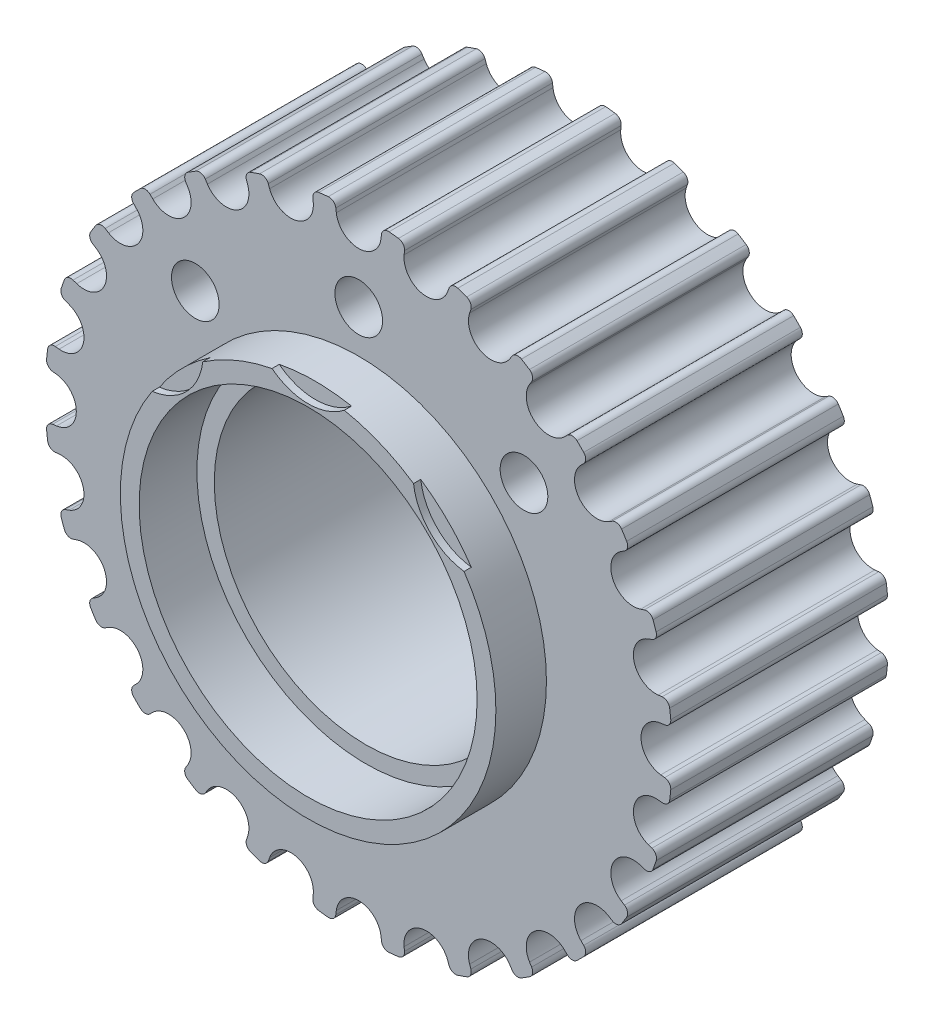
from build123d import *

# Parameters (mm, degrees)
SKETCH_2_R           = 10.5
EXTRUDE_1_DEPTH      = 15
EXTRUDE_2_DEPTH      = 3.5
EXTRUDE_2_DEPTH_BACK = 19.5
SKETCH_12_R          = 13
SKETCH_12_R_2        = 11.7
HOLE_WIZARD_M4_1_D   = 3.3
CUT_EXTRUDE_START    = -0.5
SKETCH_14_R          = 11.7
SKETCH_14_R_2        = 10.5
CUT_EXTRUDE_1_DEPTH  = 0.5
CUT_EXTRUDE_START_2  = 3.5
SKETCH_15_R          = 4.05
CUT_EXTRUDE_2_DEPTH  = 0.5
CUT_EXTRUDE_START_3  = -18
SKETCH_15_2_R        = 4.05
CUT_EXTRUDE_3_DEPTH  = 1.5
EXTRUDE_START        = 0.5
SKETCH_16_R          = 11.7
SKETCH_16_R_2        = 10.5
EXTRUDE_3_DEPTH      = 0.5


with BuildPart() as part:
    # 草图2 → 凸台-拉伸1 (new body)
    with BuildSketch(Plane.XY):
        with BuildLine():
            Line((1.331903556, 20.780403486), (1.298918642, 20.511762921))
            ThreePointArc((1.298918642, 20.511762921), (-0.249453355, 19.141879097), (-1.797825351, 20.511762921))
            Line((-1.797825351, 20.511762921), (-1.830810265, 20.780403486))
            ThreePointArc((-1.830810265, 20.780403486), (-2.006994407, 21.096415396), (-2.353762187, 21.19964565))
            ThreePointArc((-2.353762187, 21.19964565), (-2.679978202, 21.165383749), (-3.00563929, 21.12619674))
            ThreePointArc((-3.00563929, 21.12619674), (-3.320741986, 20.948391594), (-3.422189558, 20.601098103))
            Line((-3.422189558, 20.601098103), (-3.394569322, 20.331853084))
            ThreePointArc((-3.394569322, 20.331853084), (-4.599292572, 18.651769924), (-6.413671477, 19.642762718))
            Line((-6.413671477, 19.642762718), (-6.50560754, 19.897328069))
            ThreePointArc((-6.50560754, 19.897328069), (-6.747693643, 20.166212241), (-7.108738124, 20.189691206))
            ThreePointArc((-7.108738124, 20.189691206), (-7.419151232, 20.083698431), (-7.727927386, 19.973027513))
            ThreePointArc((-7.727927386, 19.973027513), (-7.995564432, 19.729563367), (-8.01718843, 19.36840304))
            Line((-8.01718843, 19.36840304), (-7.930348038, 19.112054636))
            ThreePointArc((-7.930348038, 19.112054636), (-8.731012687, 17.206018527), (-10.720417968, 17.768427773))
            Line((-10.720417968, 17.768427773), (-10.866695121, 17.996152941))
            ThreePointArc((-10.866695121, 17.996152941), (-11.162543977, 18.2044264), (-11.51976088, 18.146976743))
            ThreePointArc((-11.51976088, 18.146976743), (-11.798805672, 17.974568014), (-12.075213567, 17.797962688))
            ThreePointArc((-12.075213567, 17.797962688), (-12.281964525, 17.501047851), (-12.222680631, 17.144130775))
            Line((-12.222680631, 17.144130775), (-12.080974622, 16.913533367))
            ThreePointArc((-12.080974622, 16.913533367), (-12.437432001, 14.877120916), (-14.502106569, 14.982745068))
            Line((-14.502106569, 14.982745068), (-14.695389866, 15.172210962))
            ThreePointArc((-14.695389866, 15.172210962), (-15.030166378, 15.309430006), (-15.365643356, 15.173932493))
            ThreePointArc((-15.365643356, 15.173932493), (-15.599327361, 14.943753103), (-15.829506751, 14.710069098))
            ThreePointArc((-15.829506751, 14.710069098), (-15.965004264, 14.37459212), (-15.82778522, 14.039815608))
            Line((-15.82778522, 14.039815608), (-15.638319326, 13.846532311))
            ThreePointArc((-15.638319326, 13.846532311), (-15.532695174, 11.781857744), (-17.569107624, 11.425400364))
            Line((-17.569107624, 11.425400364), (-17.799705033, 11.567106373))
            ThreePointArc((-17.799705033, 11.567106373), (-18.156622109, 11.626390267), (-18.453536946, 11.41963931))
            ThreePointArc((-18.453536946, 11.41963931), (-18.630142271, 11.143231414), (-18.802551001, 10.864186622))
            ThreePointArc((-18.802551001, 10.864186622), (-18.860000658, 10.506969719), (-18.651727199, 10.211120863))
            Line((-18.651727199, 10.211120863), (-18.424002031, 10.06484371))
            ThreePointArc((-18.424002031, 10.06484371), (-17.861592784, 8.075438429), (-19.767628894, 7.27477378))
            Line((-19.767628894, 7.27477378), (-20.023977298, 7.361614172))
            ThreePointArc((-20.023977298, 7.361614172), (-20.385137624, 7.339990175), (-20.628601771, 7.072353128))
            ThreePointArc((-20.628601771, 7.072353128), (-20.739272689, 6.763576974), (-20.845265464, 6.453163866))
            ThreePointArc((-20.845265464, 6.453163866), (-20.821786499, 6.092119385), (-20.552902327, 5.850033282))
            Line((-20.552902327, 5.850033282), (-20.298336976, 5.75809722))
            ThreePointArc((-20.298336976, 5.75809722), (-19.307344182, 3.943718314), (-20.987427341, 2.738995064))
            Line((-20.987427341, 2.738995064), (-21.25667236, 2.7666153))
            ThreePointArc((-21.25667236, 2.7666153), (-21.603965852, 2.665167728), (-21.781770998, 2.350065032))
            ThreePointArc((-21.781770998, 2.350065032), (-21.820958007, 2.024403944), (-21.855219907, 1.69818793))
            ThreePointArc((-21.855219907, 1.69818793), (-21.751989654, 1.351420149), (-21.435977744, 1.175236007))
            Line((-21.435977744, 1.175236007), (-21.167337179, 1.142251093))
            ThreePointArc((-21.167337179, 1.142251093), (-19.797453355, -0.406120903), (-21.167337179, -1.9544929))
            Line((-21.167337179, -1.9544929), (-21.435977744, -1.987477814))
            ThreePointArc((-21.435977744, -1.987477814), (-21.751989654, -2.163661955), (-21.855219907, -2.510429736))
            ThreePointArc((-21.855219907, -2.510429736), (-21.820958007, -2.83664575), (-21.781770998, -3.162306838))
            ThreePointArc((-21.781770998, -3.162306838), (-21.603965852, -3.477409534), (-21.25667236, -3.578857107))
            Line((-21.25667236, -3.578857107), (-20.987427341, -3.55123687))
            ThreePointArc((-20.987427341, -3.55123687), (-19.307344182, -4.75596012), (-20.298336976, -6.570339026))
            Line((-20.298336976, -6.570339026), (-20.552902327, -6.662275089))
            ThreePointArc((-20.552902327, -6.662275089), (-20.821786499, -6.904361192), (-20.845265464, -7.265405672))
            ThreePointArc((-20.845265464, -7.265405672), (-20.739272689, -7.57581878), (-20.628601771, -7.884594935))
            ThreePointArc((-20.628601771, -7.884594935), (-20.385137624, -8.152231981), (-20.023977298, -8.173855979))
            Line((-20.023977298, -8.173855979), (-19.767628894, -8.087015586))
            ThreePointArc((-19.767628894, -8.087015586), (-17.861592784, -8.887680235), (-18.424002031, -10.877085516))
            Line((-18.424002031, -10.877085516), (-18.651727199, -11.023362669))
            ThreePointArc((-18.651727199, -11.023362669), (-18.860000658, -11.319211525), (-18.802551001, -11.676428428))
            ThreePointArc((-18.802551001, -11.676428428), (-18.630142271, -11.95547322), (-18.453536946, -12.231881116))
            ThreePointArc((-18.453536946, -12.231881116), (-18.156622109, -12.438632073), (-17.799705033, -12.379348179))
            Line((-17.799705033, -12.379348179), (-17.569107624, -12.237642171))
            ThreePointArc((-17.569107624, -12.237642171), (-15.532695174, -12.59409955), (-15.638319326, -14.658774118))
            Line((-15.638319326, -14.658774118), (-15.82778522, -14.852057414))
            ThreePointArc((-15.82778522, -14.852057414), (-15.965004264, -15.186833926), (-15.829506751, -15.522310905))
            ThreePointArc((-15.829506751, -15.522310905), (-15.599327361, -15.755994909), (-15.365643356, -15.9861743))
            ThreePointArc((-15.365643356, -15.9861743), (-15.030166378, -16.121671812), (-14.695389866, -15.984452768))
            Line((-14.695389866, -15.984452768), (-14.502106569, -15.794986874))
            ThreePointArc((-14.502106569, -15.794986874), (-12.437432001, -15.689362722), (-12.080974622, -17.725775173))
            Line((-12.080974622, -17.725775173), (-12.222680631, -17.956372582))
            ThreePointArc((-12.222680631, -17.956372582), (-12.281964525, -18.313289657), (-12.075213567, -18.610204494))
            ThreePointArc((-12.075213567, -18.610204494), (-11.798805672, -18.78680982), (-11.51976088, -18.95921855))
            ThreePointArc((-11.51976088, -18.95921855), (-11.162543977, -19.016668206), (-10.866695121, -18.808394748))
            Line((-10.866695121, -18.808394748), (-10.720417968, -18.58066958))
            ThreePointArc((-10.720417968, -18.58066958), (-8.731012687, -18.018260333), (-7.930348038, -19.924296443))
            Line((-7.930348038, -19.924296443), (-8.01718843, -20.180644846))
            ThreePointArc((-8.01718843, -20.180644846), (-7.995564432, -20.541805173), (-7.727927386, -20.785269319))
            ThreePointArc((-7.727927386, -20.785269319), (-7.419151232, -20.895940238), (-7.108738124, -21.001933013))
            ThreePointArc((-7.108738124, -21.001933013), (-6.747693643, -20.978454047), (-6.50560754, -20.709569876))
            Line((-6.50560754, -20.709569876), (-6.413671477, -20.455004524))
            ThreePointArc((-6.413671477, -20.455004524), (-4.599292572, -19.464011731), (-3.394569322, -21.14409489))
            Line((-3.394569322, -21.14409489), (-3.422189558, -21.413339909))
            ThreePointArc((-3.422189558, -21.413339909), (-3.320741986, -21.7606334), (-3.00563929, -21.938438546))
            ThreePointArc((-3.00563929, -21.938438546), (-2.679978202, -21.977625556), (-2.353762187, -22.011887456))
            ThreePointArc((-2.353762187, -22.011887456), (-2.006994407, -21.908657202), (-1.830810265, -21.592645292))
            Line((-1.830810265, -21.592645292), (-1.797825351, -21.324004727))
            ThreePointArc((-1.797825351, -21.324004727), (-0.249453355, -19.954120903), (1.298918642, -21.324004727))
            Line((1.298918642, -21.324004727), (1.331903556, -21.592645292))
            ThreePointArc((1.331903556, -21.592645292), (1.508087698, -21.908657202), (1.854855478, -22.011887456))
            ThreePointArc((1.854855478, -22.011887456), (2.181071493, -21.977625556), (2.506732581, -21.938438546))
            ThreePointArc((2.506732581, -21.938438546), (2.821835276, -21.7606334), (2.923282849, -21.413339909))
            Line((2.923282849, -21.413339909), (2.895662612, -21.14409489))
            ThreePointArc((2.895662612, -21.14409489), (4.100385862, -19.464011731), (5.914764768, -20.455004524))
            Line((5.914764768, -20.455004524), (6.006700831, -20.709569876))
            ThreePointArc((6.006700831, -20.709569876), (6.248786934, -20.978454047), (6.609831415, -21.001933013))
            ThreePointArc((6.609831415, -21.001933013), (6.920244522, -20.895940238), (7.229020677, -20.785269319))
            ThreePointArc((7.229020677, -20.785269319), (7.496657723, -20.541805173), (7.518281721, -20.180644846))
            Line((7.518281721, -20.180644846), (7.431441329, -19.924296443))
            ThreePointArc((7.431441329, -19.924296443), (8.232105978, -18.018260333), (10.221511258, -18.58066958))
            Line((10.221511258, -18.58066958), (10.367788412, -18.808394748))
            ThreePointArc((10.367788412, -18.808394748), (10.663637267, -19.016668206), (11.020854171, -18.95921855))
            ThreePointArc((11.020854171, -18.95921855), (11.299898962, -18.78680982), (11.576306858, -18.610204494))
            ThreePointArc((11.576306858, -18.610204494), (11.783057816, -18.313289657), (11.723773921, -17.956372582))
            Line((11.723773921, -17.956372582), (11.582067913, -17.725775173))
            ThreePointArc((11.582067913, -17.725775173), (11.938525292, -15.689362722), (14.00319986, -15.794986874))
            Line((14.00319986, -15.794986874), (14.196483156, -15.984452768))
            ThreePointArc((14.196483156, -15.984452768), (14.531259668, -16.121671812), (14.866736647, -15.9861743))
            ThreePointArc((14.866736647, -15.9861743), (15.100420651, -15.755994909), (15.330600042, -15.522310905))
            ThreePointArc((15.330600042, -15.522310905), (15.466097554, -15.186833926), (15.32887851, -14.852057414))
            Line((15.32887851, -14.852057414), (15.139412616, -14.658774118))
            ThreePointArc((15.139412616, -14.658774118), (15.033788465, -12.59409955), (17.070200915, -12.237642171))
            Line((17.070200915, -12.237642171), (17.300798324, -12.379348179))
            ThreePointArc((17.300798324, -12.379348179), (17.657715399, -12.438632073), (17.954630236, -12.231881116))
            ThreePointArc((17.954630236, -12.231881116), (18.131235562, -11.95547322), (18.303644292, -11.676428428))
            ThreePointArc((18.303644292, -11.676428428), (18.361093948, -11.319211525), (18.15282049, -11.023362669))
            Line((18.15282049, -11.023362669), (17.925095322, -10.877085516))
            ThreePointArc((17.925095322, -10.877085516), (17.362686075, -8.887680235), (19.268722185, -8.087015586))
            Line((19.268722185, -8.087015586), (19.525070588, -8.173855979))
            ThreePointArc((19.525070588, -8.173855979), (19.886230915, -8.152231981), (20.129695061, -7.884594935))
            ThreePointArc((20.129695061, -7.884594935), (20.24036598, -7.57581878), (20.346358755, -7.265405672))
            ThreePointArc((20.346358755, -7.265405672), (20.32287979, -6.904361192), (20.053995618, -6.662275089))
            Line((20.053995618, -6.662275089), (19.799430267, -6.570339026))
            ThreePointArc((19.799430267, -6.570339026), (18.808437473, -4.75596012), (20.488520632, -3.55123687))
            Line((20.488520632, -3.55123687), (20.757765651, -3.578857107))
            ThreePointArc((20.757765651, -3.578857107), (21.105059142, -3.477409534), (21.282864289, -3.162306838))
            ThreePointArc((21.282864289, -3.162306838), (21.322051298, -2.83664575), (21.356313198, -2.510429736))
            ThreePointArc((21.356313198, -2.510429736), (21.253082944, -2.163661955), (20.937071035, -1.987477814))
            Line((20.937071035, -1.987477814), (20.66843047, -1.9544929))
            ThreePointArc((20.66843047, -1.9544929), (19.298546645, -0.406120903), (20.66843047, 1.142251093))
            Line((20.66843047, 1.142251093), (20.937071035, 1.175236007))
            ThreePointArc((20.937071035, 1.175236007), (21.253082944, 1.351420149), (21.356313198, 1.69818793))
            ThreePointArc((21.356313198, 1.69818793), (21.322051298, 2.024403944), (21.282864289, 2.350065032))
            ThreePointArc((21.282864289, 2.350065032), (21.105059142, 2.665167728), (20.757765651, 2.7666153))
            Line((20.757765651, 2.7666153), (20.488520632, 2.738995064))
            ThreePointArc((20.488520632, 2.738995064), (18.808437473, 3.943718314), (19.799430267, 5.75809722))
            Line((19.799430267, 5.75809722), (20.053995618, 5.850033282))
            ThreePointArc((20.053995618, 5.850033282), (20.32287979, 6.092119385), (20.346358755, 6.453163866))
            ThreePointArc((20.346358755, 6.453163866), (20.24036598, 6.763576974), (20.129695061, 7.072353128))
            ThreePointArc((20.129695061, 7.072353128), (19.886230915, 7.339990175), (19.525070588, 7.361614172))
            Line((19.525070588, 7.361614172), (19.268722185, 7.27477378))
            ThreePointArc((19.268722185, 7.27477378), (17.362686075, 8.075438429), (17.925095322, 10.06484371))
            Line((17.925095322, 10.06484371), (18.15282049, 10.211120863))
            ThreePointArc((18.15282049, 10.211120863), (18.361093948, 10.506969719), (18.303644292, 10.864186622))
            ThreePointArc((18.303644292, 10.864186622), (18.131235562, 11.143231414), (17.954630236, 11.41963931))
            ThreePointArc((17.954630236, 11.41963931), (17.657715399, 11.626390267), (17.300798324, 11.567106373))
            Line((17.300798324, 11.567106373), (17.070200915, 11.425400364))
            ThreePointArc((17.070200915, 11.425400364), (15.033788465, 11.781857744), (15.139412616, 13.846532311))
            Line((15.139412616, 13.846532311), (15.32887851, 14.039815608))
            ThreePointArc((15.32887851, 14.039815608), (15.466097554, 14.37459212), (15.330600042, 14.710069098))
            ThreePointArc((15.330600042, 14.710069098), (15.100420651, 14.943753103), (14.866736647, 15.173932493))
            ThreePointArc((14.866736647, 15.173932493), (14.531259668, 15.309430006), (14.196483156, 15.172210962))
            Line((14.196483156, 15.172210962), (14.00319986, 14.982745068))
            ThreePointArc((14.00319986, 14.982745068), (11.938525292, 14.877120916), (11.582067913, 16.913533367))
            Line((11.582067913, 16.913533367), (11.723773921, 17.144130775))
            ThreePointArc((11.723773921, 17.144130775), (11.783057816, 17.501047851), (11.576306858, 17.797962688))
            ThreePointArc((11.576306858, 17.797962688), (11.299898962, 17.974568014), (11.020854171, 18.146976743))
            ThreePointArc((11.020854171, 18.146976743), (10.663637267, 18.2044264), (10.367788412, 17.996152941))
            Line((10.367788412, 17.996152941), (10.221511258, 17.768427773))
            ThreePointArc((10.221511258, 17.768427773), (8.232105978, 17.206018527), (7.431441329, 19.112054636))
            Line((7.431441329, 19.112054636), (7.518281721, 19.36840304))
            ThreePointArc((7.518281721, 19.36840304), (7.496657723, 19.729563367), (7.229020677, 19.973027513))
            ThreePointArc((7.229020677, 19.973027513), (6.920244522, 20.083698431), (6.609831415, 20.189691206))
            ThreePointArc((6.609831415, 20.189691206), (6.248786934, 20.166212241), (6.006700831, 19.897328069))
            Line((6.006700831, 19.897328069), (5.914764768, 19.642762718))
            ThreePointArc((5.914764768, 19.642762718), (4.100385862, 18.651769924), (2.895662612, 20.331853084))
            Line((2.895662612, 20.331853084), (2.923282849, 20.601098103))
            ThreePointArc((2.923282849, 20.601098103), (2.821835276, 20.948391594), (2.506732581, 21.12619674))
            ThreePointArc((2.506732581, 21.12619674), (2.181071493, 21.165383749), (1.854855478, 21.19964565))
            ThreePointArc((1.854855478, 21.19964565), (1.508087698, 21.096415396), (1.331903556, 20.780403486))
        make_face()
        with Locations((-0.245789015, -0.367741944)):
            Circle(SKETCH_2_R, mode=Mode.SUBTRACT)
    extrude(amount=EXTRUDE_1_DEPTH)


with BuildPart() as part_1:
    # Move Body 1: moved
    add(part.part.moved(Location((-21.775119277, 0, 0))))

    # 草图12 → 凸台-拉伸2 (add, two sides: drawn at the far end of the back side and taken through both)
    with BuildSketch(Plane.XY.offset(15).offset(-EXTRUDE_2_DEPTH_BACK)):
        with Locations((-22.024572632, -0.309578045)):
            Circle(SKETCH_12_R)
        with Locations((-22.024572632, -0.309578045)):
            Circle(SKETCH_12_R_2, mode=Mode.SUBTRACT)
    extrude(amount=EXTRUDE_2_DEPTH + EXTRUDE_2_DEPTH_BACK)

    # M4 螺纹孔1 (through all)
    with Locations(Plane(origin=(-33.334616791, 10.945966555, 15), x_dir=(1, 0, 0), z_dir=(0, 0, 1))):
        with Locations((0, 0), (11.313708499, 4.686291501), (22.755337645, -0.129383643)):
            Hole(HOLE_WIZARD_M4_1_D / 2)

    # 草图14 → 切除-拉伸1 (cut)
    with BuildSketch(Plane.XY.offset(15).offset(CUT_EXTRUDE_START)):
        with Locations((-22.024572632, -0.309578045)):
            Circle(SKETCH_14_R)
        with Locations((-22.020908292, -0.367741944)):
            Circle(SKETCH_14_R_2, mode=Mode.SUBTRACT)
    extrude(amount=CUT_EXTRUDE_1_DEPTH, mode=Mode.SUBTRACT)

    # 草图15 → 切除-拉伸2 (cut)
    with BuildSketch(Plane.XY.offset(15).offset(CUT_EXTRUDE_START_2)):
        with Locations((-22.020908292, 15.632258056)):
            Circle(SKETCH_15_R)
        with Locations((-10.707199793, 10.945966555)):
            Circle(SKETCH_15_R)
        with Locations((-33.334616791, 10.945966555)):
            Circle(SKETCH_15_R)
    extrude(amount=-CUT_EXTRUDE_2_DEPTH, mode=Mode.SUBTRACT)

    # 草图15<2> → 切除-拉伸3 (cut)
    with BuildSketch(Plane.XY.offset(15).offset(CUT_EXTRUDE_START_3)):
        with Locations((-22.020908292, 15.632258056)):
            Circle(SKETCH_15_2_R)
        with Locations((-10.707199793, 10.945966555)):
            Circle(SKETCH_15_2_R)
        with Locations((-33.334616791, 10.945966555)):
            Circle(SKETCH_15_2_R)
    extrude(amount=-CUT_EXTRUDE_3_DEPTH, mode=Mode.SUBTRACT)

    # 草图16 → 凸台-拉伸3 (add)
    with BuildSketch(Plane(origin=(0, 0, 0), x_dir=(-1, 0, 0), z_dir=(0, 0, -1)).offset(EXTRUDE_START)):
        with Locations(Location((22.024572632, -0.309578045, 0), (0, 0, 180))):
            Circle(SKETCH_16_R)
        with Locations((22.020908292, -0.367741944)):
            Circle(SKETCH_16_R_2, mode=Mode.SUBTRACT)
    extrude(amount=-EXTRUDE_3_DEPTH)


solid = part_1.part
